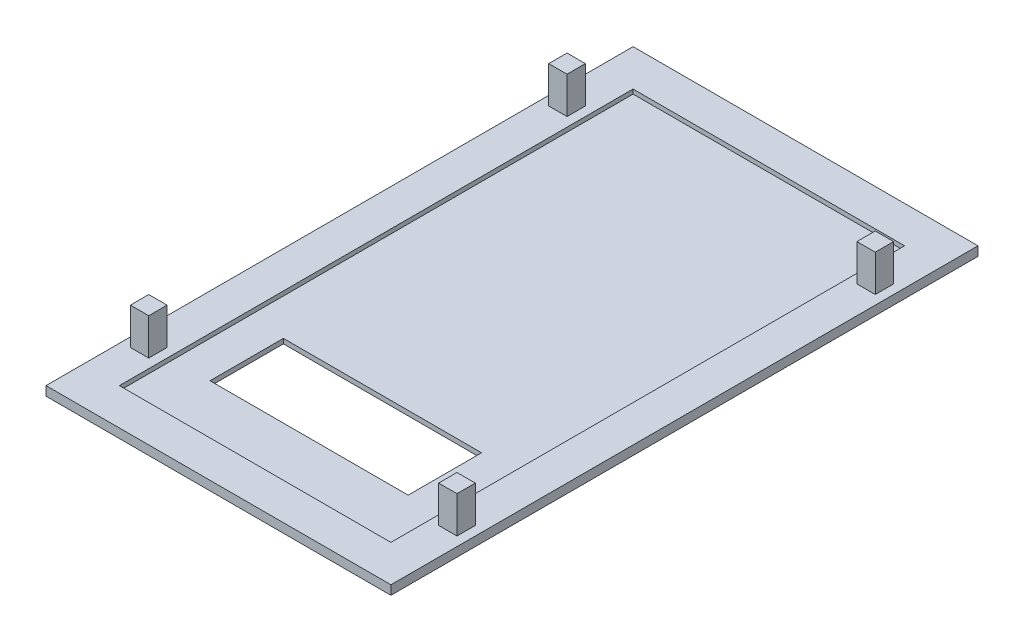
from build123d import *

# Parameters (mm, degrees)
SKETCH1_W           = 47
SKETCH1_H           = 80
BOSS_EXTRUDE1_DEPTH = 1.25
SKETCH2_W           = 2.5
SKETCH2_H           = 2.5
BOSS_EXTRUDE2_DEPTH = 5
SKETCH3_W           = 27
SKETCH3_H           = 10
CUT_EXTRUDE1_DEPTH  = 5
SKETCH6_W           = 37
SKETCH6_H           = 70
CUT_EXTRUDE2_DEPTH  = 0.6


with BuildPart() as part:
    # Sketch1 → Boss-Extrude1 (new body)
    with BuildSketch(Plane(origin=(0, 0, 0), x_dir=(1, 0, 0), z_dir=(0, 1, 0))):
        with Locations((23.5, 40)):
            Rectangle(SKETCH1_W, SKETCH1_H)
    extrude(amount=BOSS_EXTRUDE1_DEPTH)

    # Sketch2 → Boss-Extrude2 (add)
    with BuildSketch(Plane(origin=(0, 1.25, 0), x_dir=(1, 0, 0), z_dir=(0, 1, 0))):
        with Locations((44.5, 68.5)):
            Rectangle(SKETCH2_W, SKETCH2_H)
        with Locations((44.5, 11.5)):
            Rectangle(SKETCH2_W, SKETCH2_H)
        with Locations((2.5, 11.5)):
            Rectangle(SKETCH2_W, SKETCH2_H)
        with Locations((2.5, 68.5)):
            Rectangle(SKETCH2_W, SKETCH2_H)
    extrude(amount=BOSS_EXTRUDE2_DEPTH)

    # Sketch3 → Cut-Extrude1 (cut)
    with BuildSketch(Plane(origin=(0, 1.25, 0), x_dir=(1, 0, 0), z_dir=(0, 1, 0))):
        with Locations((23.5, 17.35)):
            Rectangle(SKETCH3_W, SKETCH3_H)
    extrude(amount=-CUT_EXTRUDE1_DEPTH, mode=Mode.SUBTRACT)

    # Sketch6 → Cut-Extrude2 (cut)
    with BuildSketch(Plane(origin=(0, 1.25, 0), x_dir=(1, 0, 0), z_dir=(0, 1, 0))):
        with Locations((23.5, 40)):
            Rectangle(SKETCH6_W, SKETCH6_H)
    extrude(amount=-CUT_EXTRUDE2_DEPTH, mode=Mode.SUBTRACT)


solid = part.part
